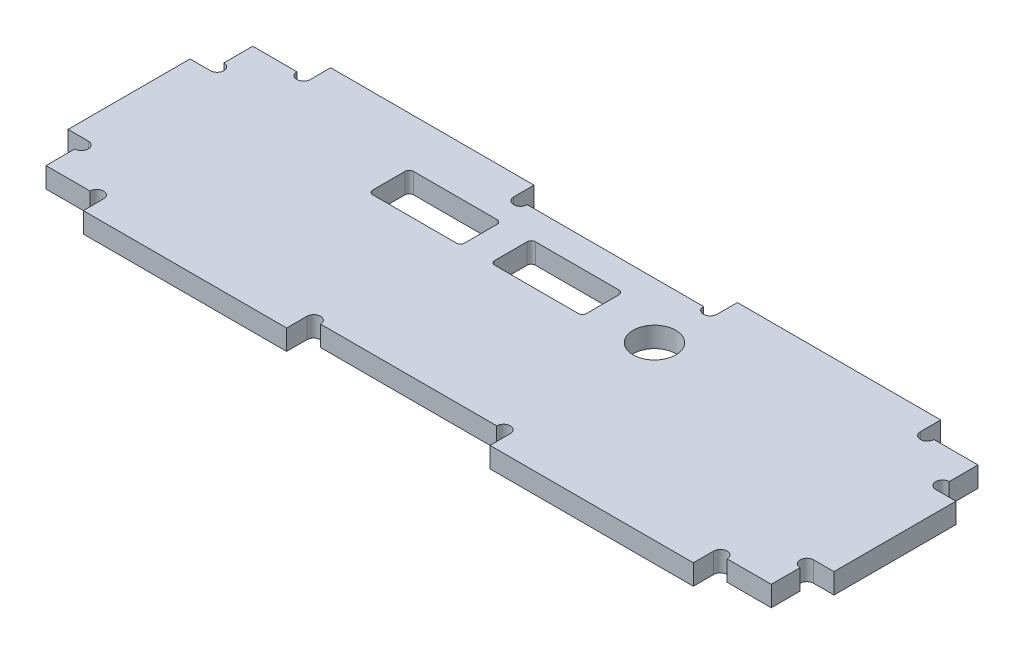
from build123d import *

# Parameters (mm, degrees)
EXTRUDE_1_DEPTH     = 1.5
SKETCH_3_R          = 3.15
CUT_EXTRUDE_2_DEPTH = 1.5
SKETCH_5_W          = 99
SKETCH_5_H          = 11.3
CUT_EXTRUDE_4_DEPTH = 10
SKETCH_6_W          = 30
SKETCH_6_H          = 3
EXTRUDE_2_DEPTH     = 3
SKETCH_8_W          = 3
SKETCH_8_H          = 18
SKETCH_8_W_2        = 4
SKETCH_8_H_2        = 30.5
EXTRUDE_3_DEPTH     = 3
SKETCH_7_R          = 1
CUT_EXTRUDE_5_DEPTH = 3


with BuildPart() as part:
    # 草图2 → 凸台-拉伸1 (new, symmetric)
    with BuildSketch(Plane(origin=(0, 0, 0), x_dir=(1, 0, 0), z_dir=(0, 1, 0))):
        Polygon((-49.5, 26.6), (-49.5, -15.2), (49.5, -15.2), (49.5, 26.599983447), align=None)
    extrude(amount=EXTRUDE_1_DEPTH, both=True)

    # 草图3 → 切除-拉伸2 (cut, symmetric)
    with BuildSketch(Plane(origin=(0, 0, 0), x_dir=(1, 0, 0), z_dir=(0, 1, 0))):
        with Locations(Location((13.999999636, 7.069989383, 0), (0, 0, 270))):
            Circle(SKETCH_3_R)
        with BuildLine():
            Line((5.275, 10.57), (5.275, 5.77))
            ThreePointArc((5.275, 5.77), (5.099264069, 5.345735931), (4.675, 5.17))
            Line((4.675, 5.17), (-7.675, 5.17))
            ThreePointArc((-7.675, 5.17), (-8.099264069, 5.345735931), (-8.275, 5.77))
            Line((-8.275, 5.77), (-8.275, 10.57))
            ThreePointArc((-8.275, 10.57), (-8.099264069, 10.994264069), (-7.675, 11.17))
            Line((-7.675, 11.17), (4.675, 11.17))
            ThreePointArc((4.675, 11.17), (5.099264069, 10.994264069), (5.275, 10.57))
        make_face()
        with BuildLine():
            Line((-13.325, 5.17), (-25.675, 5.17))
            ThreePointArc((-25.675, 5.17), (-26.099264069, 5.345735931), (-26.275, 5.77))
            Line((-26.275, 5.77), (-26.275, 10.57))
            ThreePointArc((-26.275, 10.57), (-26.099264069, 10.994264069), (-25.675, 11.17))
            Line((-25.675, 11.17), (-13.325, 11.17))
            ThreePointArc((-13.325, 11.17), (-12.900735931, 10.994264069), (-12.725, 10.57))
            Line((-12.725, 10.57), (-12.725, 5.77))
            ThreePointArc((-12.725, 5.77), (-12.900735931, 5.345735931), (-13.325, 5.17))
        make_face()
    extrude(amount=CUT_EXTRUDE_2_DEPTH, both=True, mode=Mode.SUBTRACT)

    # 草图5 → 切除-拉伸4 (cut)
    with BuildSketch(Plane.XZ.offset(1.5)):
        with Locations((0, -20.95)):
            Rectangle(SKETCH_5_W, SKETCH_5_H)
    extrude(amount=-CUT_EXTRUDE_4_DEPTH, mode=Mode.SUBTRACT)

    # 草图6 → 凸台-拉伸2 (add)
    with BuildSketch(Plane.XY.offset(15.2)):
        with Locations((30, 0)):
            Rectangle(SKETCH_6_W, SKETCH_6_H)
        with Locations((-30, 0)):
            Rectangle(SKETCH_6_W, SKETCH_6_H)
    extrude_2 = extrude(amount=EXTRUDE_2_DEPTH)

    # 镜向1: 凸台-拉伸2 across plane
    add(extrude_2.mirror(Plane.XY.offset(-0.05)))

    # 草图8 → 凸台-拉伸3 (add)
    with BuildSketch(Plane(origin=(0, 1.5, 0), x_dir=(1, 0, 0), z_dir=(0, 1, 0))):
        with Locations((-55, 0.05)):
            Rectangle(SKETCH_8_W, SKETCH_8_H)
        with Locations((-51.5, 0.05)):
            Rectangle(SKETCH_8_W_2, SKETCH_8_H_2)
        Polygon((53.5, -15.2), (53.5, -8.95), (53.5, 9.05), (53.5, 15.3), (49.5, 15.3), (49.5, -15.2), align=None)
        with Locations((55, 0.05)):
            Rectangle(SKETCH_8_W, SKETCH_8_H)
    extrude(amount=-EXTRUDE_3_DEPTH)

    # 草图7 → 切除-拉伸5 (cut)
    with BuildSketch(Plane(origin=(0, 1.5, 0), x_dir=(1, 0, 0), z_dir=(0, 1, 0))):
        with Locations((-14, 15.3)):
            Circle(SKETCH_7_R)
        with Locations((14, 15.3)):
            Circle(SKETCH_7_R)
        with Locations((46, 15.3)):
            Circle(SKETCH_7_R)
        with Locations((14, -15.2)):
            Circle(SKETCH_7_R)
        with Locations((-14, -15.2)):
            Circle(SKETCH_7_R)
        with Locations((-46, -15.2)):
            Circle(SKETCH_7_R)
        with Locations((-46, 15.3)):
            Circle(SKETCH_7_R)
        with Locations((46, -15.2)):
            Circle(SKETCH_7_R)
        with Locations((-53.5, 10.05)):
            Circle(SKETCH_7_R)
        with Locations((-53.5, -9.95)):
            Circle(SKETCH_7_R)
        with Locations((53.5, 10.05)):
            Circle(SKETCH_7_R)
        with Locations((53.5, -9.95)):
            Circle(SKETCH_7_R)
    extrude(amount=-CUT_EXTRUDE_5_DEPTH, mode=Mode.SUBTRACT)


solid = part.part
